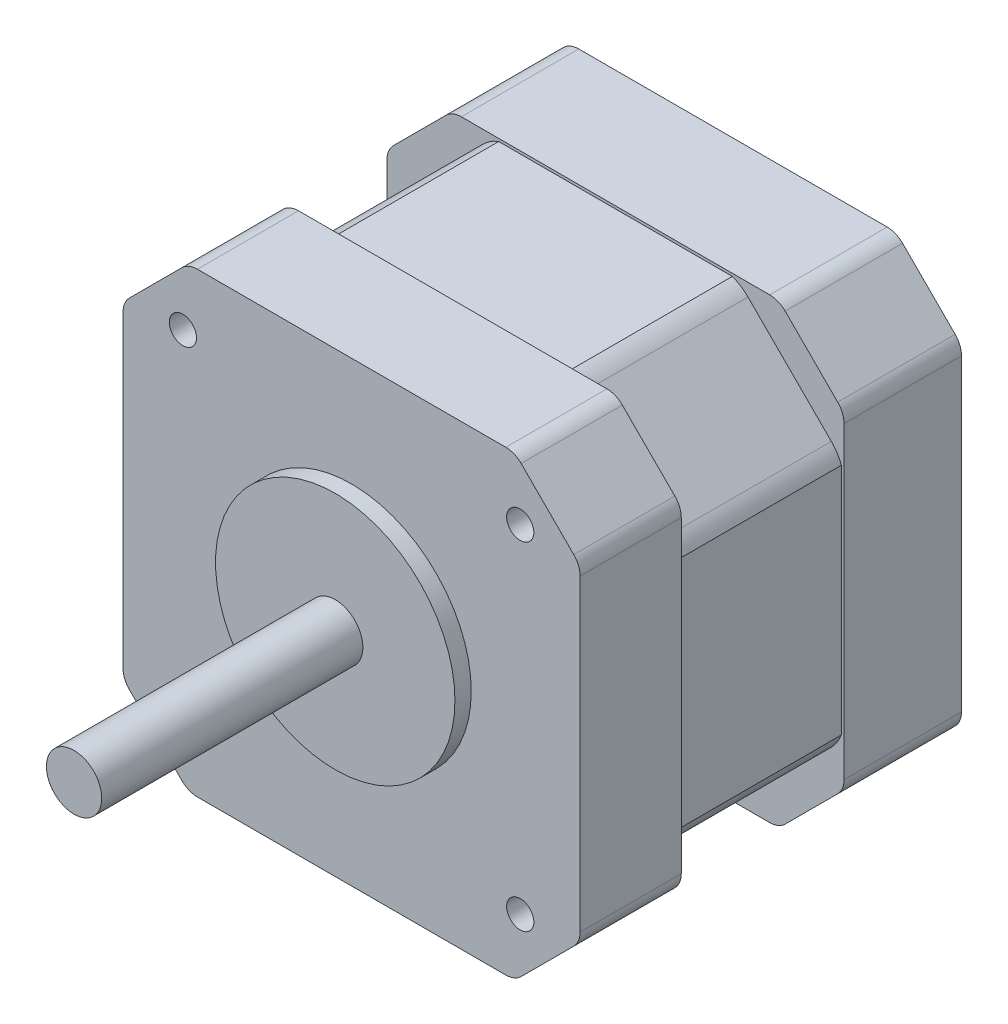
from build123d import *

# Parameters (mm, degrees)
BOSS_EXTRUDE1_DEPTH       = 9.2964
BOSS_EXTRUDE2_DEPTH       = 16.002
BOSS_EXTRUDE3_DEPTH       = 10.795
SKETCH4_R                 = 11
BOSS_EXTRUDE4_DEPTH       = 1.5
SKETCH5_R                 = 2.54
BOSS_EXTRUDE5_DEPTH       = 24
F_2_CLEARANCE_HOLE1_D     = 2.5
F_2_CLEARANCE_HOLE1_DEPTH = 6
F_2_CLEARANCE_HOLE1_TIP   = 0.751075774
FILLET1_R                 = 2


with BuildPart() as part:
    # Sketch1 → Boss-Extrude1 (new body)
    with BuildSketch(Plane.XY.offset(8)):
        Polygon((-21, 15), (-21, -15), (-15, -21), (15, -21), (21, -15), (21, 15), (15, 21), (-15, 21), align=None)
    extrude(amount=-BOSS_EXTRUDE1_DEPTH)

    # Sketch2 → Boss-Extrude2 (add)
    with BuildSketch(Plane(origin=(0, 0, -1.2964), x_dir=(-1, 0, 0), z_dir=(0, 0, -1))):
        with BuildLine():
            Line((-10.735086841, 20.75), (10.735086841, 20.75))
            ThreePointArc((10.735086841, 20.75), (11.503053413, 20.366719307), (12.171572875, 19.828427125))
            Line((12.171572875, 19.828427125), (19.828427125, 12.171572875))
            ThreePointArc((19.828427125, 12.171572875), (20.366719307, 11.503053413), (20.75, 10.735086841))
            Line((20.75, 10.735086841), (20.75, -10.735086841))
            ThreePointArc((20.75, -10.735086841), (20.366719307, -11.503053413), (19.828427125, -12.171572875))
            Line((19.828427125, -12.171572875), (12.171572875, -19.828427125))
            ThreePointArc((12.171572875, -19.828427125), (11.503053413, -20.366719307), (10.735086841, -20.75))
            Line((10.735086841, -20.75), (-10.735086841, -20.75))
            ThreePointArc((-10.735086841, -20.75), (-11.503053413, -20.366719307), (-12.171572875, -19.828427125))
            Line((-12.171572875, -19.828427125), (-19.828427125, -12.171572875))
            ThreePointArc((-19.828427125, -12.171572875), (-20.366719307, -11.503053413), (-20.75, -10.735086841))
            Line((-20.75, -10.735086841), (-20.75, 10.735086841))
            ThreePointArc((-20.75, 10.735086841), (-20.366719307, 11.503053413), (-19.828427125, 12.171572875))
            Line((-19.828427125, 12.171572875), (-12.171572875, 19.828427125))
            ThreePointArc((-12.171572875, 19.828427125), (-11.503053413, 20.366719307), (-10.735086841, 20.75))
        make_face()
    extrude(amount=BOSS_EXTRUDE2_DEPTH)

    # Sketch3 → Boss-Extrude3 (add)
    with BuildSketch(Plane.XY.offset(-16.256)):
        Polygon((-21, 15), (-21, -15), (-15, -21), (15, -21), (21, -15), (21, 15), (15, 21), (-15, 21), align=None)
    extrude(amount=-BOSS_EXTRUDE3_DEPTH)

    # Sketch4 → Boss-Extrude4 (add)
    with BuildSketch(Plane.XY.offset(8)):
        Circle(SKETCH4_R)
    extrude(amount=BOSS_EXTRUDE4_DEPTH)

    # Sketch5 → Boss-Extrude5 (add)
    with BuildSketch(Plane.XY.offset(9.5)):
        Circle(SKETCH5_R)
    extrude(amount=BOSS_EXTRUDE5_DEPTH)

    # #2 Clearance Hole1
    with Locations(Plane.XY.offset(8)):
        with Locations((-15.5, 15.5), (15.5, 15.5), (-15.5, -15.5), (15.5, -15.5)):
            Hole(F_2_CLEARANCE_HOLE1_D / 2, depth=F_2_CLEARANCE_HOLE1_DEPTH)
            with Locations((0, 0, -(F_2_CLEARANCE_HOLE1_DEPTH + F_2_CLEARANCE_HOLE1_TIP / 2))):  # 118° drill point
                Cone(0, F_2_CLEARANCE_HOLE1_D / 2, F_2_CLEARANCE_HOLE1_TIP, mode=Mode.SUBTRACT)

    # Fillet1
    fillet1_edges = [part.edges().sort_by_distance(p)[0] for p in [
        (-15, 21, 3.3518),
        (15, 21, 3.3518),
        (21, 15, 3.3518),
        (21, -15, 3.3518),
        (15, -21, 3.3518),
        (-15, -21, 3.3518),
        (-21, -15, 3.3518),
        (-21, 15, 3.3518),
        (-21, 15, -21.6535),
        (-15, 21, -21.6535),
        (15, 21, -21.6535),
        (21, 15, -21.6535),
        (21, -15, -21.6535),
        (15, -21, -21.6535),
        (-15, -21, -21.6535),
        (-21, -15, -21.6535),
    ]]
    fillet(fillet1_edges, radius=FILLET1_R)


solid = part.part
